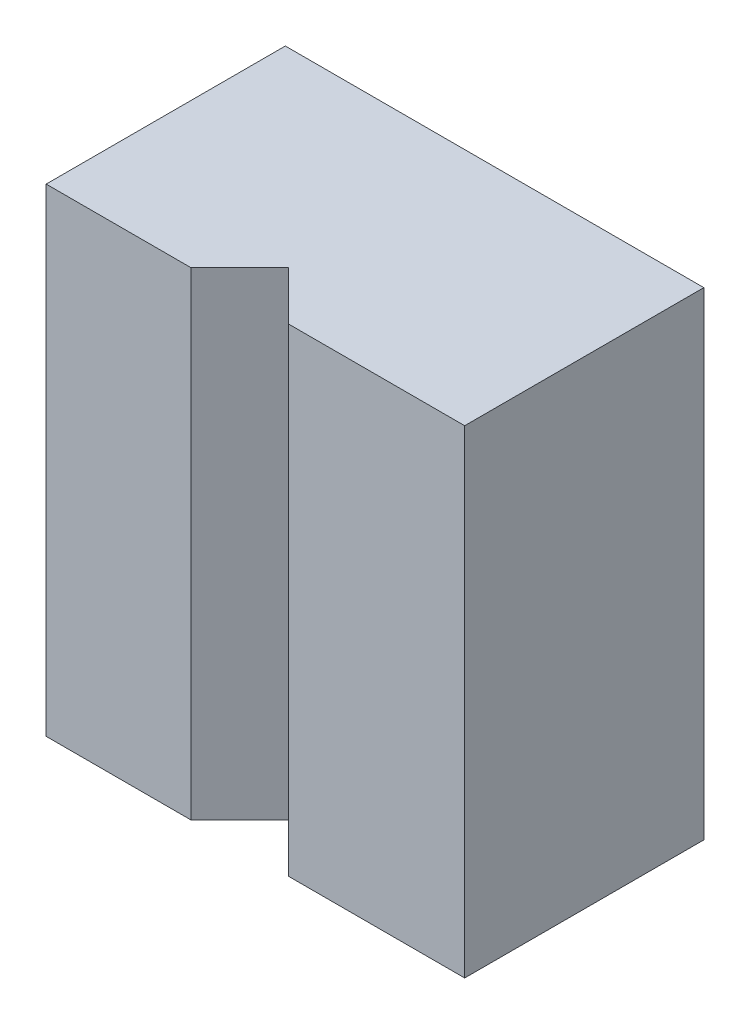
from build123d import *

# Parameters (mm, degrees)
SKETCH1_W               = 101.6
SKETCH1_H               = 50.8
BOSS_EXTRUDE1_DEPTH     = 101.6
CUT_EXTRUDE1_DEPTH      = 153.4
CUT_EXTRUDE1_DEPTH_BACK = 153.4
CUT_EXTRUDE2_DEPTH      = 153.4
CUT_EXTRUDE2_DEPTH_BACK = 153.4
SKETCH3_W               = 12.7
SKETCH3_H               = 50.8


with BuildPart() as part:
    # Sketch1 → Boss-Extrude1 (new body)
    with BuildSketch(Plane(origin=(0, 0, 0), x_dir=(1, 0, 0), z_dir=(0, 1, 0))):
        with Locations((-50.8, 25.4)):
            Rectangle(SKETCH1_W, SKETCH1_H)
    extrude(amount=BOSS_EXTRUDE1_DEPTH)

    # Sketch2 → Cut-Extrude1 (cut, two sides: drawn at the far end of the back side and taken through both)
    with BuildSketch(Plane(origin=(0, 101.6, 0), x_dir=(1, 0, 0), z_dir=(0, 1, 0)).offset(-CUT_EXTRUDE1_DEPTH_BACK)):
        Polygon((85.31205923, -122.77705923), (-37.465, 0), (-47.792294539, 10.327294539), (-58.119589078, 0), (-180.896648308, -122.77705923), (-180.896648308, -470.043023852), (85.31205923, -470.043023852), align=None)
    extrude(amount=CUT_EXTRUDE1_DEPTH + CUT_EXTRUDE1_DEPTH_BACK, mode=Mode.SUBTRACT)

    # Sketch3 → Cut-Extrude2 (cut, two sides: drawn at the far end of the back side and taken through both)
    with BuildSketch(Plane.XZ.offset(-CUT_EXTRUDE2_DEPTH_BACK)):
        with Locations((-95.25, -25.4)):
            Rectangle(SKETCH3_W, SKETCH3_H)
    extrude(amount=CUT_EXTRUDE2_DEPTH + CUT_EXTRUDE2_DEPTH_BACK, mode=Mode.SUBTRACT)


solid = part.part
